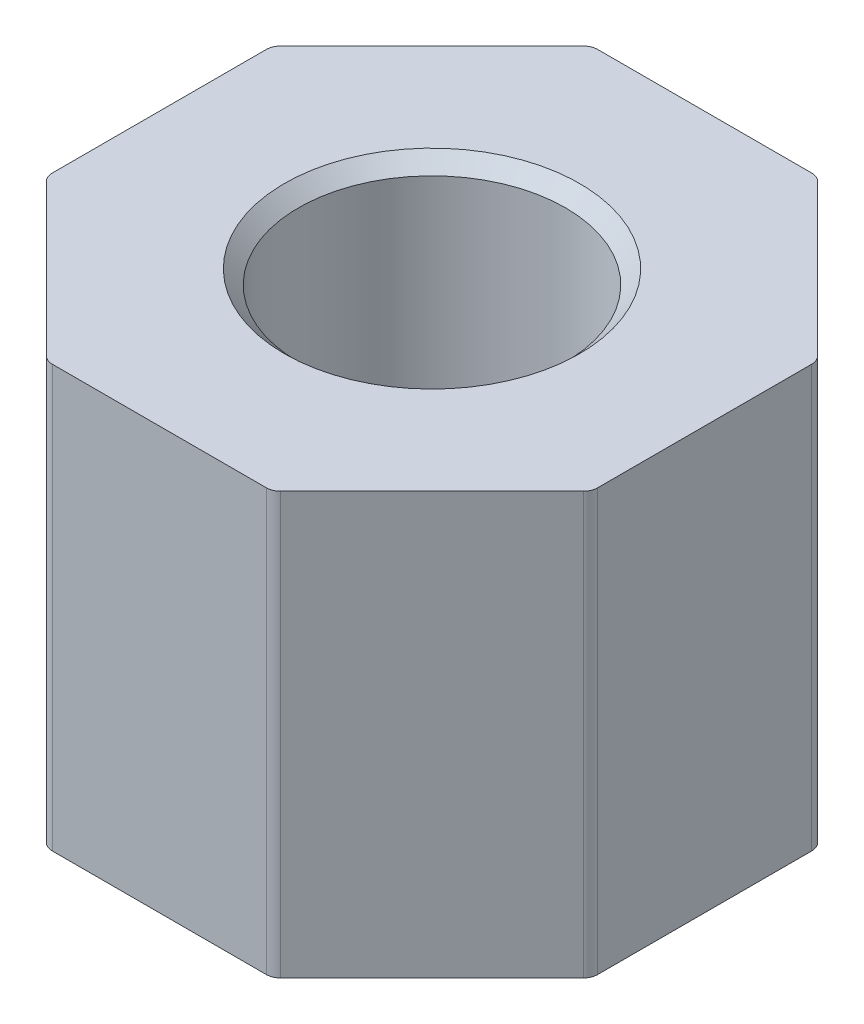
from build123d import *

# Parameters (mm, degrees)
BOSS_EXTRUDE1_DEPTH = 30
SKETCH3_R           = 9.5
CUT_EXTRUDE1_DEPTH  = 41.655062299
CHAMFER1_SIZE       = 1
FILLET1_R           = 1


with BuildPart() as part:
    # Sketch2 → Boss-Extrude1 (new body)
    with BuildSketch(Plane(origin=(0, 0, 0), x_dir=(1, 0, 0), z_dir=(0, 1, 0))):
        Polygon((19.401470183, -8.03635208), (19.401470183, 8.03635208), (8.03635208, 19.401470183), (-8.03635208, 19.401470183), (-19.401470183, 8.03635208), (-19.401470183, -8.03635208), (-8.03635208, -19.401470183), (8.03635208, -19.401470183), align=None)
    extrude(amount=BOSS_EXTRUDE1_DEPTH)

    # Sketch3 → Cut-Extrude1 (cut, through all)
    with BuildSketch(Plane(origin=(0, 30, 0), x_dir=(1, 0, 0), z_dir=(0, 1, 0))):
        with Locations(Location((0, 0, 0), (0, 0, 270))):
            Circle(SKETCH3_R)
    extrude(amount=-CUT_EXTRUDE1_DEPTH, mode=Mode.SUBTRACT)

    # Chamfer1
    chamfer1_edges = [part.edges().sort_by_distance(p)[0] for p in [
        (0, 0, -9.5),
        (0, 30, -9.5),
    ]]
    chamfer(chamfer1_edges, length=CHAMFER1_SIZE)

    # Fillet1
    fillet1_edges = [part.edges().sort_by_distance(p)[0] for p in [
        (19.401470183, 15, -8.03635208),
        (19.401470183, 15, 8.03635208),
        (8.03635208, 15, 19.401470183),
        (-8.03635208, 15, 19.401470183),
        (-19.401470183, 15, 8.03635208),
        (-19.401470183, 15, -8.03635208),
        (-8.03635208, 15, -19.401470183),
        (8.03635208, 15, -19.401470183),
    ]]
    fillet(fillet1_edges, radius=FILLET1_R)


solid = part.part
